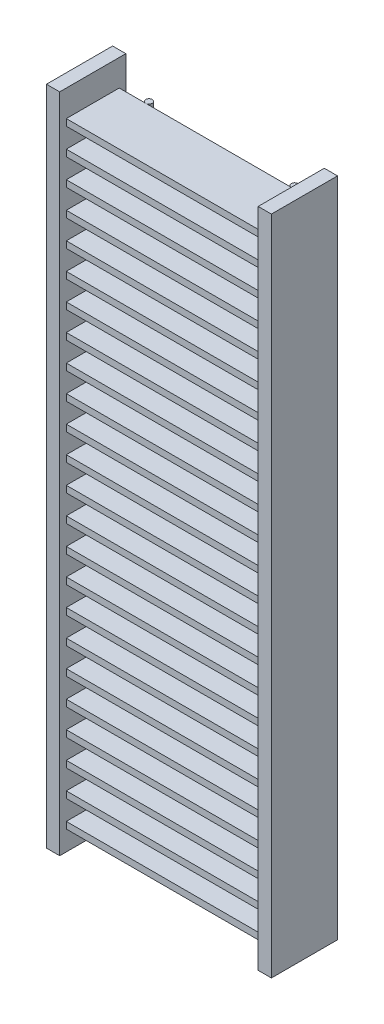
from build123d import *

# Parameters (mm, degrees)
SKETCH1_W             = 10
SKETCH1_H             = 500
BOSS_EXTRUDE1_DEPTH   = 50
BOSS_EXTRUDE1_2_DEPTH = 50
SKETCH2_W             = 40
SKETCH2_H             = 5
BOSS_EXTRUDE2_DEPTH   = 160
LPATTERN1_COUNT       = 24
LPATTERN1_PITCH       = 20
SKETCH4_R             = 2.5
BOSS_EXTRUDE3_DEPTH   = 465
BOSS_EXTRUDE3_2_DEPTH = 465


with BuildPart() as part:
    # Sketch1 → Boss-Extrude1 (new body)
    with BuildSketch(Plane.XY):
        with Locations((-80, -119.615384615)):
            Rectangle(SKETCH1_W, SKETCH1_H)
    extrude(amount=BOSS_EXTRUDE1_DEPTH)



with BuildPart() as body_2:
    # Sketch1 → Boss-Extrude1 2 (new body)
    with BuildSketch(Plane.XY):
        with Locations((80, -119.615384615)):
            Rectangle(SKETCH1_W, SKETCH1_H)
    extrude(amount=BOSS_EXTRUDE1_2_DEPTH)


with BuildPart() as part_1:
    add(part.part)

    add(body_2.part)  # Boss-Extrude2 merges body 2
    # Sketch2 → Boss-Extrude2 (add)
    with BuildSketch(Plane(origin=(-75, 0, 0), x_dir=(0, 0, -1), z_dir=(1, 0, 0))):
        with Locations((-25, 107.884615385)):
            Rectangle(SKETCH2_W, SKETCH2_H)
    boss_extrude2 = extrude(amount=BOSS_EXTRUDE2_DEPTH)

    # LPattern1: Boss-Extrude2 ×24
    with Locations(*[(0, -i * LPATTERN1_PITCH, 0) for i in range(1, LPATTERN1_COUNT)]):
        add(boss_extrude2)


with BuildPart() as body_2_2:
    # Sketch4 → Boss-Extrude3 (new body)
    with BuildSketch(Plane(origin=(0, 110.384615385, 0), x_dir=(1, 0, 0), z_dir=(0, 1, 0))):
        with Locations(Location((-55, -2.5, 0), (0, 0, 180))):
            Circle(SKETCH4_R)
    extrude(amount=-BOSS_EXTRUDE3_DEPTH)


with BuildPart() as body_3:
    # Sketch4 → Boss-Extrude3 2 (new body)
    with BuildSketch(Plane(origin=(0, 110.384615385, 0), x_dir=(1, 0, 0), z_dir=(0, 1, 0))):
        with Locations(Location((55, -2.5, 0), (0, 0, 180))):
            Circle(SKETCH4_R)
    extrude(amount=-BOSS_EXTRUDE3_2_DEPTH)


solid = Compound([part_1.part, body_2_2.part, body_3.part])
